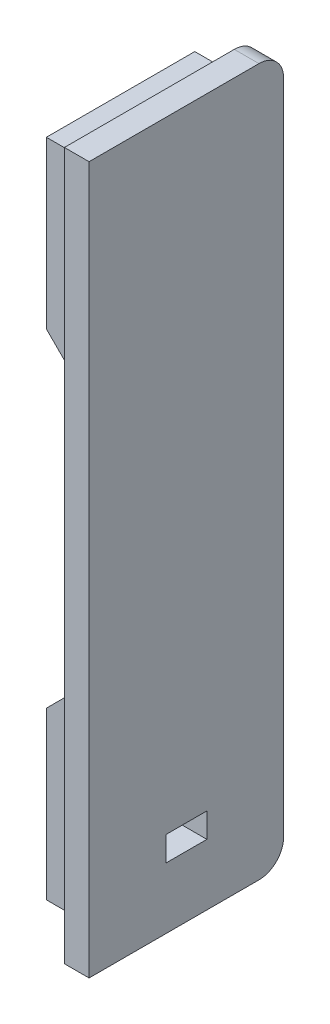
from build123d import *

# Parameters (mm, degrees)
BOSS_EXTRUDE1_DEPTH     = 3
SKETCH2_W               = 5
SKETCH2_H               = 3
CUT_EXTRUDE1_DEPTH      = 45.699303997
SKETCH3_W               = 18.054262684
SKETCH3_H               = 80.34146894
BOSS_EXTRUDE2_DEPTH     = 5
SKETCH5_W               = 11.91581337
SKETCH5_H               = 76.008445896
CUT_EXTRUDE2_DEPTH      = 5
CUT_EXTRUDE3_DEPTH      = 45.877920827
CUT_EXTRUDE3_DEPTH_BACK = 45.877920827
SKETCH7_W               = 2
SKETCH7_H               = 9
BOSS_EXTRUDE3_DEPTH     = 5
CUT_EXTRUDE4_DEPTH      = 5
SKETCH9_W               = 2.534423144
SKETCH9_H               = 2
CUT_EXTRUDE5_DEPTH      = 1
CUT_EXTRUDE6_DEPTH      = 2
BOSS_EXTRUDE5_DEPTH     = 2
BOSS_EXTRUDE6_DEPTH     = 2
CUT_EXTRUDE7_START      = -2
CUT_EXTRUDE7_DEPTH      = 2


with BuildPart() as part:
    # Sketch1 → Boss-Extrude1 (new body)
    with BuildSketch(Plane(origin=(0, 0, 0), x_dir=(0, 0, -1), z_dir=(1, 0, 0))):
        with BuildLine():
            Line((-11.833333333, -43), (8.833333333, -43))
            ThreePointArc((8.833333333, -43), (10.954653677, -42.121320344), (11.833333333, -40))
            Line((11.833333333, -40), (11.833333333, 40))
            ThreePointArc((11.833333333, 40), (10.954653677, 42.121320344), (8.833333333, 43))
            Line((8.833333333, 43), (-11.833333333, 43))
            Line((-11.833333333, 43), (-11.833333333, -43))
        make_face()
    extrude(amount=BOSS_EXTRUDE1_DEPTH)

    # Sketch2 → Cut-Extrude1 (cut, through all)
    with BuildSketch(Plane(origin=(3, 0, 0), x_dir=(0, 0, -1), z_dir=(1, 0, 0))):
        with Locations((0, -34.060962647)):
            Rectangle(SKETCH2_W, SKETCH2_H)
    extrude(amount=-CUT_EXTRUDE1_DEPTH, mode=Mode.SUBTRACT)

    # Sketch3 → Boss-Extrude2 (add)
    with BuildSketch(Plane.ZY):
        Rectangle(SKETCH3_W, SKETCH3_H)
    extrude(amount=BOSS_EXTRUDE2_DEPTH)

    # Sketch5 → Cut-Extrude2 (cut)
    with BuildSketch(Plane.ZY.offset(5)):
        Rectangle(SKETCH5_W, SKETCH5_H)
    extrude(amount=-CUT_EXTRUDE2_DEPTH, mode=Mode.SUBTRACT)

    # Sketch6 → Cut-Extrude3 (cut, two sides: drawn at the far end of the back side and taken through both)
    with BuildSketch(Plane.XY.offset(-CUT_EXTRUDE3_DEPTH_BACK)):
        Polygon((-5, -19.974207963), (-1.714874455, -16.689082418), (-1.714874455, 16.689082418), (-5, 19.974207963), align=None)
    extrude(amount=CUT_EXTRUDE3_DEPTH + CUT_EXTRUDE3_DEPTH_BACK, mode=Mode.SUBTRACT)

    # Sketch7 → Boss-Extrude3 (add)
    with BuildSketch(Plane.ZY):
        Rectangle(SKETCH7_W, SKETCH7_H)
    extrude(amount=BOSS_EXTRUDE3_DEPTH)

    # Sketch8 → Cut-Extrude4 (cut)
    with BuildSketch(Plane.XY.offset(1)):
        with BuildLine():
            ThreePointArc((-5, -0.459578833), (-2.44210099, -2.530530169), (0, -0.32421434))
            Line((0, -0.32421434), (0, 0.32421434))
            ThreePointArc((0, 0.32421434), (-2.44210099, 2.530530169), (-5, 0.459578833))
            Line((-5, 0.459578833), (-5, -0.459578833))
        make_face()
        with BuildLine():
            Line((-5, -4.5), (-2.510609776, -4.5))
            ThreePointArc((-2.510609776, -4.5), (-3.81075192, -4.308088951), (-5, -3.748724625))
            Line((-5, -3.748724625), (-5, -4.5))
        make_face()
        with BuildLine():
            Line((-2.510609776, -4.5), (0, -4.5))
            Line((0, -4.5), (0, -3.734546632))
            ThreePointArc((0, -3.734546632), (-1.198256898, -4.304384965), (-2.510609776, -4.5))
        make_face()
        with BuildLine():
            ThreePointArc((-2.510609794, 4.5), (-1.198256907, 4.304384967), (0, 3.734546632))
            Line((0, 3.734546632), (0, 4.5))
            Line((0, 4.5), (-2.510609794, 4.5))
        make_face()
        with BuildLine():
            ThreePointArc((-5, 3.748724625), (-3.810751929, 4.308088948), (-2.510609794, 4.5))
            Line((-2.510609794, 4.5), (-5, 4.5))
            Line((-5, 4.5), (-5, 3.748724625))
        make_face()
    extrude(amount=-CUT_EXTRUDE4_DEPTH, mode=Mode.SUBTRACT)

    # Sketch9 → Cut-Extrude5 (cut)
    with BuildSketch(Plane.ZY.offset(5)):
        Rectangle(SKETCH9_W, SKETCH9_H)
    extrude(amount=-CUT_EXTRUDE5_DEPTH, mode=Mode.SUBTRACT)

    # Sketch12 → Cut-Extrude6 (cut)
    with BuildSketch(Plane.XY.offset(1)):
        with BuildLine():
            Line((-4.836179898, -1), (-5, -1))
            Line((-5, -1), (-5, -3.748724625))
            ThreePointArc((-5, -3.748724625), (-2.497849634, -4.499981909), (0, -3.734546632))
            Line((0, -3.734546632), (0, -0.32421434))
            ThreePointArc((0, -0.32421434), (-2.160279243, -2.507098902), (-4.836179898, -1))
        make_face()
        with BuildLine():
            Line((-5, 3.748724625), (-5, 1))
            Line((-5, 1), (-4.836179898, 1))
            ThreePointArc((-4.836179898, 1), (-2.160279243, 2.507098902), (0, 0.32421434))
            Line((0, 0.32421434), (0, 3.734546632))
            ThreePointArc((0, 3.734546632), (-2.497849634, 4.499981909), (-5, 3.748724625))
        make_face()
    extrude(amount=-CUT_EXTRUDE6_DEPTH, mode=Mode.SUBTRACT)

    # Sketch10 → Boss-Extrude5 (add)
    with BuildSketch(Plane.XY.offset(1)):
        with BuildLine():
            Line((0.632034053, -1.144834058), (-0.193, -4.453864907))
            ThreePointArc((-0.193, -4.453864907), (-2.801828378, -4.592278965), (-5.047908598, -3.258012274))
            Line((-5.047908598, -3.258012274), (-4.41989103, -0.739171385))
            Line((-4.41989103, -0.739171385), (-4.335953587, -0.66680401))
            ThreePointArc((-4.335953587, -0.66680401), (-2.053682052, -3.002243354), (0.632034053, -1.144834058))
        make_face()
        with BuildLine():
            Line((-5.047908598, 3.258012274), (-4.41989103, 0.739171385))
            Line((-4.41989103, 0.739171385), (-4.335953587, 0.66680401))
            ThreePointArc((-4.335953587, 0.66680401), (-2.053682052, 3.002243354), (0.632034053, 1.144834058))
            Line((0.632034053, 1.144834058), (-0.193, 4.453864907))
            ThreePointArc((-0.193, 4.453864907), (-2.801828378, 4.592278965), (-5.047908598, 3.258012274))
        make_face()
    extrude(amount=-BOSS_EXTRUDE5_DEPTH)

    # Sketch13 → Boss-Extrude6 (add)
    with BuildSketch(Plane(origin=(0, 0, -1), x_dir=(-1, 0, 0), z_dir=(0, 0, -1))):
        Polygon((0, 3.679784186), (0.193, 4.453864907), (-0.617433114, 4.244828064), (-0.739085506, -4.079345447), (0.193, -4.453864907), (0, -3.679784186), (0, -2.250971384), (0, 2.250971384), align=None)
    extrude(amount=-BOSS_EXTRUDE6_DEPTH)

    # Sketch15 → Cut-Extrude7 (cut)
    with BuildSketch(Plane(origin=(0, 0, -1), x_dir=(-1, 0, 0), z_dir=(0, 0, -1)).offset(CUT_EXTRUDE7_START)):
        Polygon((4.65583066, 1.685473556), (5.047908598, 3.258012274), (4.038538563, 1.685473556), align=None)
        with BuildLine():
            Line((4.65583066, 1.685473556), (4.038538563, 1.685473556))
            ThreePointArc((4.038538563, 1.685473556), (4.241224486, 1.191898546), (4.335953587, 0.66680401))
            Line((4.335953587, 0.66680401), (4.41989103, 0.739171385))
            Line((4.41989103, 0.739171385), (4.65583066, 1.685473556))
        make_face()
        with BuildLine():
            ThreePointArc((4.335953587, -0.66680401), (4.241224486, -1.191898546), (4.038538563, -1.685473556))
            Line((4.038538563, -1.685473556), (4.65583066, -1.685473556))
            Line((4.65583066, -1.685473556), (4.41989103, -0.739171385))
            Line((4.41989103, -0.739171385), (4.335953587, -0.66680401))
        make_face()
        Polygon((4.65583066, -1.685473556), (4.038538563, -1.685473556), (5.047908598, -3.258012274), align=None)
    extrude(amount=CUT_EXTRUDE7_DEPTH, mode=Mode.SUBTRACT)


solid = part.part
